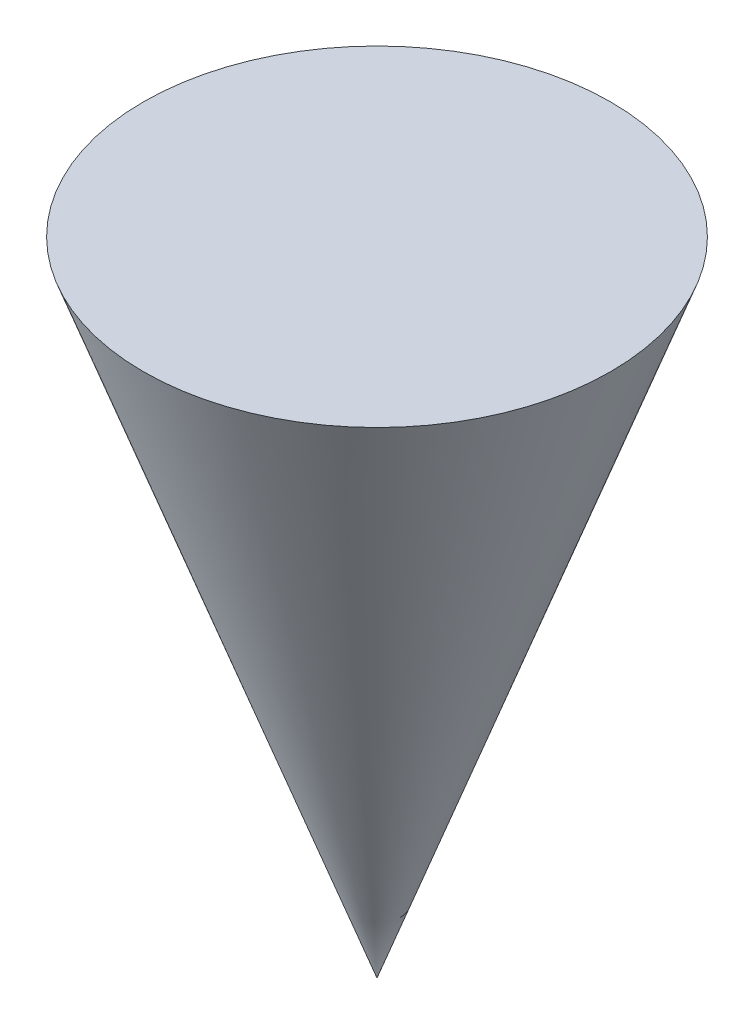
from build123d import *


with BuildPart() as part:
    # Sketch1 → Revolve1 (revolve)
    with BuildSketch(Plane.XY, mode=Mode.PRIVATE) as revolve1_sk:
        Polygon((-36.397023427, 100), (0, 0), (0, 100), align=None)
    revolve(revolve1_sk.sketch.rotate(Axis((0, 0, 0), (0, 1, 0)), 90), axis=Axis((0, 0, 0), (0, 1, 0)))


solid = part.part
